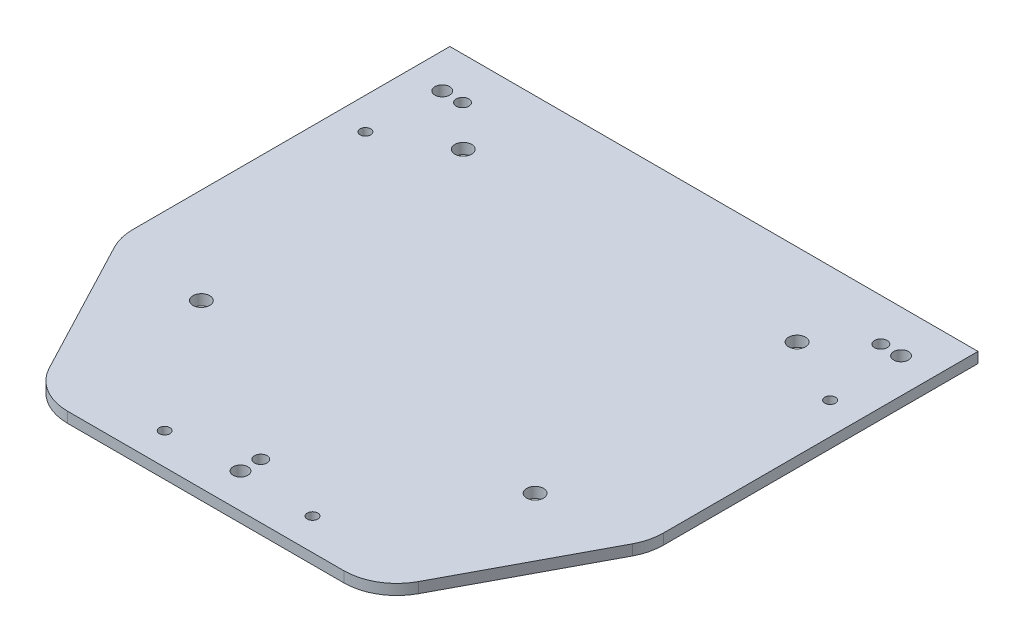
from build123d import *

# Parameters (mm, degrees)
RESSALTO_EXTRUS_O4_DEPTH = 5
ESBO_O2_R                = 2.5
CORTE_EXTRUS_O1_DEPTH    = 5
ESBO_O3_R                = 4
CORTE_EXTRUS_O2_DEPTH    = 5
ESBO_O4_R                = 3.5
ESBO_O4_R_2              = 3
CORTE_EXTRUS_O3_DEPTH    = 10


with BuildPart() as part:
    # Esboço1 → Ressalto-extrusão4 (new body)
    with BuildSketch(Plane(origin=(0, 0, 0), x_dir=(1, 0, 0), z_dir=(0, 1, 0))):
        with BuildLine():
            Line((649.267355398, 124.203004206), (399.267355398, 124.203004206))
            Line((399.267355398, 124.203004206), (399.267355398, 84.203004206))
            Line((399.267355398, 84.203004206), (399.267355398, -25.823867232))
            ThreePointArc((399.267355398, -25.823867232), (399.994184105, -31.80827659), (402.132407827, -37.444714707))
            Line((402.132407827, -37.444714707), (436.243300323, -102.417843269))
            ThreePointArc((436.243300323, -102.417843269), (445.44614031, -112.192336255), (458.378247894, -115.796995794))
            Line((458.378247894, -115.796995794), (504.267355398, -115.796995794))
            Line((504.267355398, -115.796995794), (544.267355398, -115.796995794))
            Line((544.267355398, -115.796995794), (589.136322684, -115.796995794))
            ThreePointArc((589.136322684, -115.796995794), (602.010224955, -112.227409704), (611.207767027, -102.53800702))
            Line((611.207767027, -102.53800702), (646.338799741, -36.496622823))
            ThreePointArc((646.338799741, -36.496622823), (648.524169993, -30.805979), (649.267355398, -24.755611597))
            Line((649.267355398, -24.755611597), (649.267355398, 84.203004206))
            Line((649.267355398, 84.203004206), (649.267355398, 124.203004206))
        make_face()
    extrude(amount=RESSALTO_EXTRUS_O4_DEPTH)

    # Esboço2 → Corte-extrusão1 (cut)
    with BuildSketch(Plane(origin=(0, 5, 0), x_dir=(1, 0, 0), z_dir=(0, 1, 0))):
        with Locations(Location((559.267355398, -100.796995794, 0), (0, 0, 270))):
            Circle(ESBO_O2_R)
        with Locations(Location((489.267355398, -100.796995794, 0), (0, 0, 270))):
            Circle(ESBO_O2_R)
        with Locations(Location((634.267355398, 69.203004206, 0), (0, 0, 270))):
            Circle(ESBO_O2_R)
        with Locations(Location((414.267355398, 69.203004206, 0), (0, 0, 270))):
            Circle(ESBO_O2_R)
    extrude(amount=-CORTE_EXTRUS_O1_DEPTH, mode=Mode.SUBTRACT)

    # Esboço3 → Corte-extrusão2 (cut)
    with BuildSketch(Plane(origin=(0, 5, 0), x_dir=(1, 0, 0), z_dir=(0, 1, 0))):
        with Locations(Location((602.59531099, 85.223299861, 0), (0, 0, 270))):
            Circle(ESBO_O3_R)
        with Locations(Location((444.59531099, 85.223299861, 0), (0, 0, 270))):
            Circle(ESBO_O3_R)
        with Locations(Location((602.59531099, -38.776700139, 0), (0, 0, 270))):
            Circle(ESBO_O3_R)
        with Locations(Location((444.59531099, -38.776700139, 0), (0, 0, 270))):
            Circle(ESBO_O3_R)
    extrude(amount=-CORTE_EXTRUS_O2_DEPTH, mode=Mode.SUBTRACT)

    # Esboço4 → Corte-extrusão3 (cut)
    with BuildSketch(Plane(origin=(0, 5, 0), x_dir=(1, 0, 0), z_dir=(0, 1, 0))):
        with Locations(Location((523.757285289, -99.396995794, 0), (0, 0, 270))):
            Circle(ESBO_O4_R)
        with Locations(Location((632.867355398, 104.203004206, 0), (0, 0, 270))):
            Circle(ESBO_O4_R)
        with Locations(Location((415.667355398, 104.203004206, 0), (0, 0, 270))):
            Circle(ESBO_O4_R)
        with Locations(Location((623.267355398, 104.203004206, 0), (0, 0, 270))):
            Circle(ESBO_O4_R_2)
        with Locations(Location((425.267355398, 104.203004206, 0), (0, 0, 270))):
            Circle(ESBO_O4_R_2)
        with Locations(Location((523.757285289, -89.796995794, 0), (0, 0, 270))):
            Circle(ESBO_O4_R_2)
    extrude(amount=-CORTE_EXTRUS_O3_DEPTH, mode=Mode.SUBTRACT)


solid = part.part
